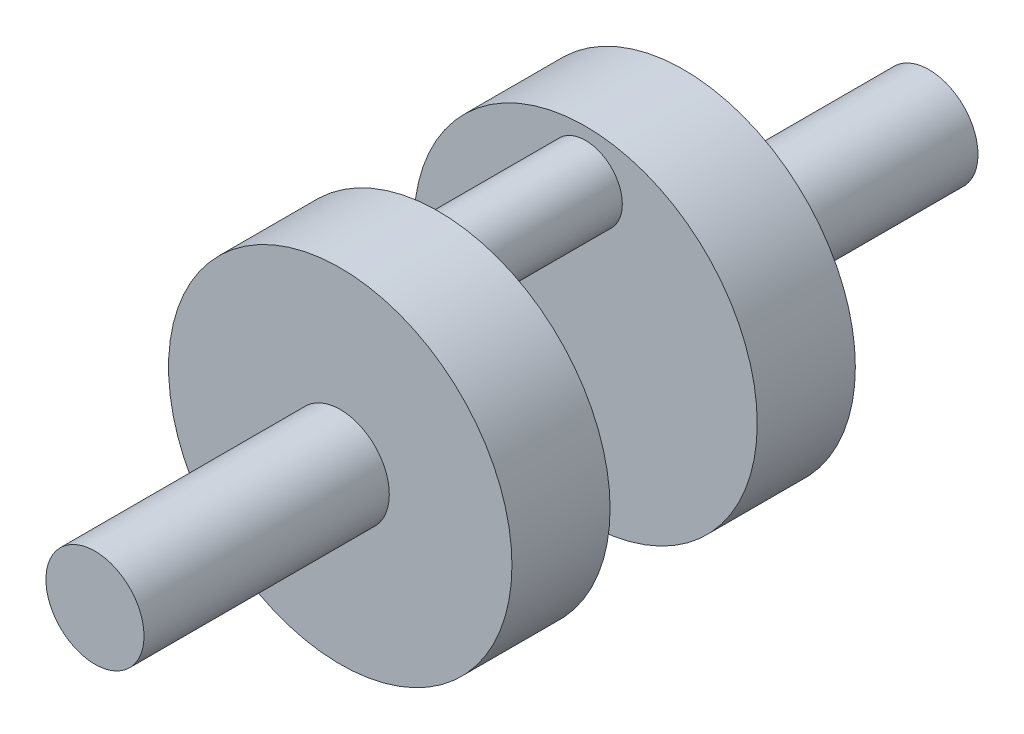
from build123d import *

# Parameters (mm, degrees)
SKETCH1_R           = 7.5
BOSS_EXTRUDE1_DEPTH = 30
SKETCH1_4_R         = 35
SKETCH1_4_R_2       = 10
BOSS_EXTRUDE2_DEPTH = 20
BOSS_EXTRUDE3_START = -50
SKETCH1_5_R         = 35
SKETCH1_5_R_2       = 10
BOSS_EXTRUDE3_DEPTH = 20
SKETCH1_6_R         = 10
BOSS_EXTRUDE4_DEPTH = 70
BOSS_EXTRUDE5_START = -100
SKETCH1_7_R         = 10
BOSS_EXTRUDE5_DEPTH = 70


with BuildPart() as part:
    # Sketch1 → Boss-Extrude1 (new body)
    with BuildSketch(Plane.XY):
        with Locations((0, 25)):
            Circle(SKETCH1_R)
    extrude(amount=-BOSS_EXTRUDE1_DEPTH)

    # Sketch1<4> → Boss-Extrude2 (add)
    with BuildSketch(Plane.XY):
        Circle(SKETCH1_4_R)
        Circle(SKETCH1_4_R_2, mode=Mode.SUBTRACT)
    extrude(amount=BOSS_EXTRUDE2_DEPTH)

    # Sketch1<5> → Boss-Extrude3 (add)
    with BuildSketch(Plane.XY.offset(BOSS_EXTRUDE3_START)):
        Circle(SKETCH1_5_R)
        Circle(SKETCH1_5_R_2, mode=Mode.SUBTRACT)
    extrude(amount=BOSS_EXTRUDE3_DEPTH)

    # Sketch1<6> → Boss-Extrude4 (add)
    with BuildSketch(Plane.XY):
        Circle(SKETCH1_6_R)
    extrude(amount=BOSS_EXTRUDE4_DEPTH)

    # Sketch1<7> → Boss-Extrude5 (add)
    with BuildSketch(Plane.XY.offset(BOSS_EXTRUDE5_START)):
        Circle(SKETCH1_7_R)
    extrude(amount=BOSS_EXTRUDE5_DEPTH)


solid = part.part
